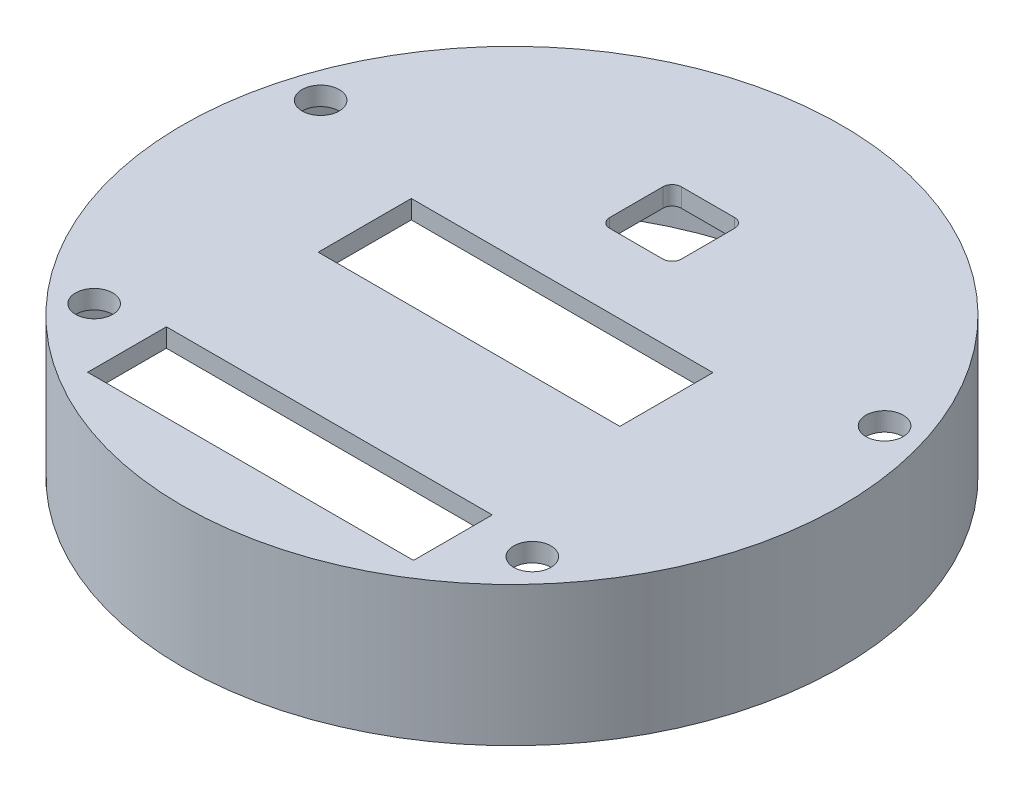
from build123d import *

# Parameters (mm, degrees)
SKETCH1_R           = 175
BOSS_EXTRUDE1_DEPTH = 10
SKETCH3_R           = 10
SKETCH3_W           = 162
SKETCH3_H           = 50
SKETCH3_W_2         = 175
SKETCH3_H_2         = 42.297309852
CUT_EXTRUDE2_DEPTH  = 10
CUT_EXTRUDE3_DEPTH  = 10
BOSS_EXTRUDE2_START = -75
SKETCH5_R           = 177
SKETCH5_R_2         = 175
BOSS_EXTRUDE2_DEPTH = 75


with BuildPart() as part:
    # Sketch1 → Boss-Extrude1 (new body)
    with BuildSketch(Plane(origin=(0, 0, 0), x_dir=(1, 0, 0), z_dir=(0, 1, 0))):
        with Locations(Location((0, 0, 0), (0, 0, 270))):
            Circle(SKETCH1_R)
    extrude(amount=BOSS_EXTRUDE1_DEPTH)

    # Sketch3 → Cut-Extrude2 (cut)
    with BuildSketch(Plane.XZ):
        with Locations(Location((-117.665653332, 106.704862813, 0), (0, 0, 270))):
            Circle(SKETCH3_R)
        with Locations(Location((117.665653332, 106.704862813, 0), (0, 0, 270))):
            Circle(SKETCH3_R)
        with Locations(Location((151.426262726, -48.693236313, 0), (0, 0, 270))):
            Circle(SKETCH3_R)
        with Locations(Location((-151.426262726, -48.693236313, 0), (0, 0, 270))):
            Circle(SKETCH3_R)
        with Locations((-0.423800225, -2.37885536)):
            Rectangle(SKETCH3_W, SKETCH3_H)
        with Locations((0, 119.225084577)):
            Rectangle(SKETCH3_W_2, SKETCH3_H_2)
    extrude(amount=-CUT_EXTRUDE2_DEPTH, mode=Mode.SUBTRACT)

    # Sketch4 → Cut-Extrude3 (cut)
    with BuildSketch(Plane.XZ):
        with BuildLine():
            Line((-14.298045865, -66.747113031), (14.298045865, -66.747113031))
            ThreePointArc((14.298045865, -66.747113031), (17.831426019, -68.210687012), (19.295, -71.744067166))
            Line((19.295, -71.744067166), (19.295, -100.340158896))
            ThreePointArc((19.295, -100.340158896), (17.832240237, -103.873462582), (14.299305419, -105.337113031))
            Line((14.299305419, -105.337113031), (-14.298045712, -105.337113031))
            ThreePointArc((-14.298045712, -105.337113031), (-17.831350955, -103.874338314), (-19.295, -100.341395166))
            Line((-19.295, -100.341395166), (-19.295, -71.744067166))
            ThreePointArc((-19.295, -71.744067166), (-17.831426019, -68.210687012), (-14.298045865, -66.747113031))
        make_face()
    extrude(amount=-CUT_EXTRUDE3_DEPTH, mode=Mode.SUBTRACT)

    # Sketch5 → Boss-Extrude2 (add)
    with BuildSketch(Plane(origin=(0, 10, 0), x_dir=(1, 0, 0), z_dir=(0, 1, 0)).offset(BOSS_EXTRUDE2_START)):
        with Locations(Location((0, 0, 0), (0, 0, 270))):
            Circle(SKETCH5_R)
        with Locations(Location((0, 0, 0), (0, 0, 270))):
            Circle(SKETCH5_R_2, mode=Mode.SUBTRACT)
    extrude(amount=BOSS_EXTRUDE2_DEPTH)


solid = part.part
